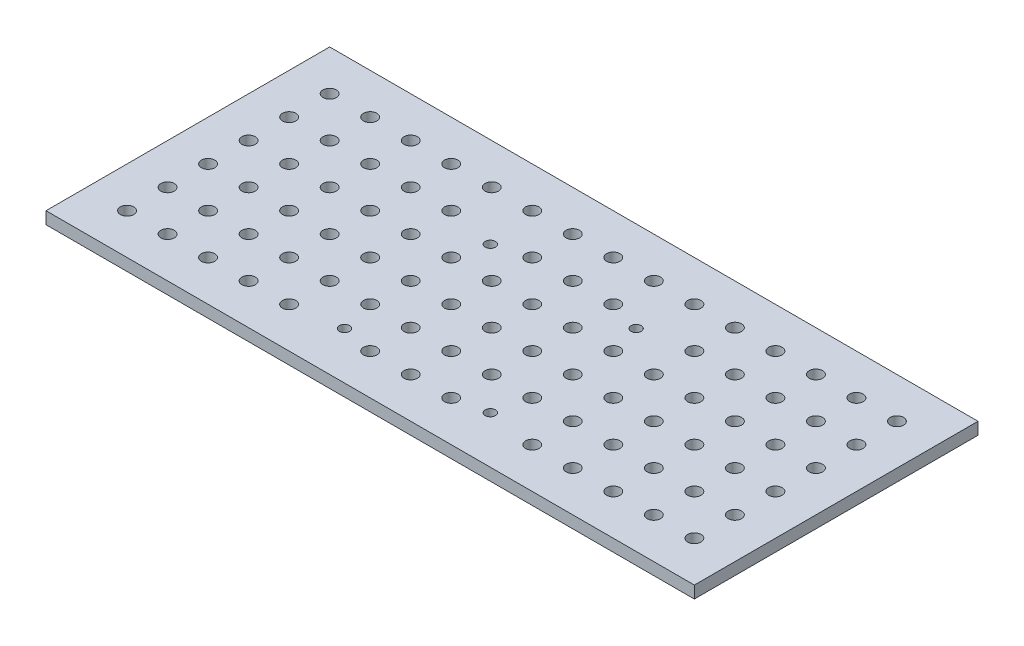
from build123d import *

# Parameters (mm, degrees)
SKETCH_1_W          = 160
SKETCH_1_H          = 70
EXTRUDE_1_DEPTH     = 3
SKETCH_2_R          = 1.65
CUT_EXTRUDE_1_DEPTH = 3
SKETCH_3_R          = 1.65
EXTRUDE_2_DEPTH     = 3
CUT_EXTRUDE_2_DEPTH = 3


with BuildPart() as part:
    # 草图1 → 凸台-拉伸1 (new body)
    with BuildSketch(Plane(origin=(0, 0, 0), x_dir=(1, 0, 0), z_dir=(0, 1, 0))):
        Rectangle(SKETCH_1_W, SKETCH_1_H)
    extrude(amount=EXTRUDE_1_DEPTH)

    # 草图2 → 切除-拉伸1 (cut)
    with BuildSketch(Plane(origin=(0, 3, 0), x_dir=(1, 0, 0), z_dir=(0, 1, 0))):
        with Locations(Location((-70, 25, 0), (0, 0, 270))):
            Circle(SKETCH_2_R)
        with Locations(Location((-60, 25, 0), (0, 0, 270))):
            Circle(SKETCH_2_R)
        with Locations(Location((-50, 25, 0), (0, 0, 270))):
            Circle(SKETCH_2_R)
        with Locations(Location((-40, 25, 0), (0, 0, 270))):
            Circle(SKETCH_2_R)
        with Locations(Location((-30, 25, 0), (0, 0, 270))):
            Circle(SKETCH_2_R)
        with Locations(Location((-20, 25, 0), (0, 0, 270))):
            Circle(SKETCH_2_R)
        with Locations(Location((-10, 25, 0), (0, 0, 270))):
            Circle(SKETCH_2_R)
        with Locations(Location((0, 25, 0), (0, 0, 270))):
            Circle(SKETCH_2_R)
        with Locations(Location((10, 25, 0), (0, 0, 270))):
            Circle(SKETCH_2_R)
        with Locations(Location((20, 25, 0), (0, 0, 270))):
            Circle(SKETCH_2_R)
        with Locations(Location((30, 25, 0), (0, 0, 270))):
            Circle(SKETCH_2_R)
        with Locations(Location((40, 25, 0), (0, 0, 270))):
            Circle(SKETCH_2_R)
        with Locations(Location((50, 25, 0), (0, 0, 270))):
            Circle(SKETCH_2_R)
        with Locations(Location((60, 25, 0), (0, 0, 270))):
            Circle(SKETCH_2_R)
        with Locations(Location((70, 25, 0), (0, 0, 270))):
            Circle(SKETCH_2_R)
        with Locations(Location((-60, 15, 0), (0, 0, 270))):
            Circle(SKETCH_2_R)
        with Locations(Location((-50, 15, 0), (0, 0, 270))):
            Circle(SKETCH_2_R)
        with Locations(Location((-40, 15, 0), (0, 0, 270))):
            Circle(SKETCH_2_R)
        with Locations(Location((-30, 15, 0), (0, 0, 270))):
            Circle(SKETCH_2_R)
        with Locations(Location((-20, 15, 0), (0, 0, 270))):
            Circle(SKETCH_2_R)
        with Locations(Location((-10, 15, 0), (0, 0, 270))):
            Circle(SKETCH_2_R)
        with Locations(Location((0, 15, 0), (0, 0, 270))):
            Circle(SKETCH_2_R)
        with Locations(Location((10, 15, 0), (0, 0, 270))):
            Circle(SKETCH_2_R)
        with Locations(Location((20, 15, 0), (0, 0, 270))):
            Circle(SKETCH_2_R)
        with Locations(Location((30, 15, 0), (0, 0, 270))):
            Circle(SKETCH_2_R)
        with Locations(Location((40, 15, 0), (0, 0, 270))):
            Circle(SKETCH_2_R)
        with Locations(Location((50, 15, 0), (0, 0, 270))):
            Circle(SKETCH_2_R)
        with Locations(Location((60, 15, 0), (0, 0, 270))):
            Circle(SKETCH_2_R)
        with Locations(Location((70, 15, 0), (0, 0, 270))):
            Circle(SKETCH_2_R)
        with Locations(Location((-60, 5, 0), (0, 0, 270))):
            Circle(SKETCH_2_R)
        with Locations(Location((-50, 5, 0), (0, 0, 270))):
            Circle(SKETCH_2_R)
        with Locations(Location((-40, 5, 0), (0, 0, 270))):
            Circle(SKETCH_2_R)
        with Locations(Location((-30, 5, 0), (0, 0, 270))):
            Circle(SKETCH_2_R)
        with Locations(Location((-20, 5, 0), (0, 0, 270))):
            Circle(SKETCH_2_R)
        with Locations(Location((-10, 5, 0), (0, 0, 270))):
            Circle(SKETCH_2_R)
        with Locations(Location((0, 5, 0), (0, 0, 270))):
            Circle(SKETCH_2_R)
        with Locations(Location((10, 5, 0), (0, 0, 270))):
            Circle(SKETCH_2_R)
        with Locations(Location((20, 5, 0), (0, 0, 270))):
            Circle(SKETCH_2_R)
        with Locations(Location((30, 5, 0), (0, 0, 270))):
            Circle(SKETCH_2_R)
        with Locations(Location((40, 5, 0), (0, 0, 270))):
            Circle(SKETCH_2_R)
        with Locations(Location((50, 5, 0), (0, 0, 270))):
            Circle(SKETCH_2_R)
        with Locations(Location((60, 5, 0), (0, 0, 270))):
            Circle(SKETCH_2_R)
        with Locations(Location((70, 5, 0), (0, 0, 270))):
            Circle(SKETCH_2_R)
        with Locations(Location((-60, -5, 0), (0, 0, 270))):
            Circle(SKETCH_2_R)
        with Locations(Location((-50, -5, 0), (0, 0, 270))):
            Circle(SKETCH_2_R)
        with Locations(Location((-40, -5, 0), (0, 0, 270))):
            Circle(SKETCH_2_R)
        with Locations(Location((-30, -5, 0), (0, 0, 270))):
            Circle(SKETCH_2_R)
        with Locations(Location((-20, -5, 0), (0, 0, 270))):
            Circle(SKETCH_2_R)
        with Locations(Location((-10, -5, 0), (0, 0, 270))):
            Circle(SKETCH_2_R)
        with Locations(Location((0, -5, 0), (0, 0, 270))):
            Circle(SKETCH_2_R)
        with Locations(Location((10, -5, 0), (0, 0, 270))):
            Circle(SKETCH_2_R)
        with Locations(Location((20, -5, 0), (0, 0, 270))):
            Circle(SKETCH_2_R)
        with Locations(Location((30, -5, 0), (0, 0, 270))):
            Circle(SKETCH_2_R)
        with Locations(Location((40, -5, 0), (0, 0, 270))):
            Circle(SKETCH_2_R)
        with Locations(Location((50, -5, 0), (0, 0, 270))):
            Circle(SKETCH_2_R)
        with Locations(Location((60, -5, 0), (0, 0, 270))):
            Circle(SKETCH_2_R)
        with Locations(Location((70, -5, 0), (0, 0, 270))):
            Circle(SKETCH_2_R)
        with Locations(Location((-60, -15, 0), (0, 0, 270))):
            Circle(SKETCH_2_R)
        with Locations(Location((-50, -15, 0), (0, 0, 270))):
            Circle(SKETCH_2_R)
        with Locations(Location((-40, -15, 0), (0, 0, 270))):
            Circle(SKETCH_2_R)
        with Locations(Location((-30, -15, 0), (0, 0, 270))):
            Circle(SKETCH_2_R)
        with Locations(Location((-20, -15, 0), (0, 0, 270))):
            Circle(SKETCH_2_R)
        with Locations(Location((-10, -15, 0), (0, 0, 270))):
            Circle(SKETCH_2_R)
        with Locations(Location((0, -15, 0), (0, 0, 270))):
            Circle(SKETCH_2_R)
        with Locations(Location((10, -15, 0), (0, 0, 270))):
            Circle(SKETCH_2_R)
        with Locations(Location((20, -15, 0), (0, 0, 270))):
            Circle(SKETCH_2_R)
        with Locations(Location((30, -15, 0), (0, 0, 270))):
            Circle(SKETCH_2_R)
        with Locations(Location((40, -15, 0), (0, 0, 270))):
            Circle(SKETCH_2_R)
        with Locations(Location((50, -15, 0), (0, 0, 270))):
            Circle(SKETCH_2_R)
        with Locations(Location((60, -15, 0), (0, 0, 270))):
            Circle(SKETCH_2_R)
        with Locations(Location((70, -15, 0), (0, 0, 270))):
            Circle(SKETCH_2_R)
        with Locations(Location((-60, -25, 0), (0, 0, 270))):
            Circle(SKETCH_2_R)
        with Locations(Location((-50, -25, 0), (0, 0, 270))):
            Circle(SKETCH_2_R)
        with Locations(Location((-40, -25, 0), (0, 0, 270))):
            Circle(SKETCH_2_R)
        with Locations(Location((-30, -25, 0), (0, 0, 270))):
            Circle(SKETCH_2_R)
        with Locations(Location((-20, -25, 0), (0, 0, 270))):
            Circle(SKETCH_2_R)
        with Locations(Location((-10, -25, 0), (0, 0, 270))):
            Circle(SKETCH_2_R)
        with Locations(Location((0, -25, 0), (0, 0, 270))):
            Circle(SKETCH_2_R)
        with Locations(Location((10, -25, 0), (0, 0, 270))):
            Circle(SKETCH_2_R)
        with Locations(Location((20, -25, 0), (0, 0, 270))):
            Circle(SKETCH_2_R)
        with Locations(Location((30, -25, 0), (0, 0, 270))):
            Circle(SKETCH_2_R)
        with Locations(Location((40, -25, 0), (0, 0, 270))):
            Circle(SKETCH_2_R)
        with Locations(Location((50, -25, 0), (0, 0, 270))):
            Circle(SKETCH_2_R)
        with Locations(Location((60, -25, 0), (0, 0, 270))):
            Circle(SKETCH_2_R)
        with Locations(Location((70, -25, 0), (0, 0, 270))):
            Circle(SKETCH_2_R)
        with Locations(Location((-70, 15, 0), (0, 0, 270))):
            Circle(SKETCH_2_R)
        with Locations(Location((-70, 5, 0), (0, 0, 270))):
            Circle(SKETCH_2_R)
        with Locations(Location((-70, -5, 0), (0, 0, 270))):
            Circle(SKETCH_2_R)
        with Locations(Location((-70, -15, 0), (0, 0, 270))):
            Circle(SKETCH_2_R)
        with Locations(Location((-70, -25, 0), (0, 0, 270))):
            Circle(SKETCH_2_R)
    extrude(amount=-CUT_EXTRUDE_1_DEPTH, mode=Mode.SUBTRACT)

    # 草图3 → 凸台-拉伸2 (add)
    with BuildSketch(Plane(origin=(0, 3, 0), x_dir=(1, 0, 0), z_dir=(0, 1, 0))):
        with Locations((-20, 15)):
            Circle(SKETCH_3_R)
        with Locations((20, 15)):
            Circle(SKETCH_3_R)
        with Locations((20, -25)):
            Circle(SKETCH_3_R)
        with Locations((-20, -25)):
            Circle(SKETCH_3_R)
    extrude(amount=-EXTRUDE_2_DEPTH)

    # 草图4 → 切除-拉伸2 (cut)
    with BuildSketch(Plane(origin=(0, 3, 0), x_dir=(1, 0, 0), z_dir=(0, 1, 0))):
        with BuildLine():
            Line((-18, 11.4), (-18, 12.65))
            Line((-18, 12.65), (-16.75, 12.65))
            ThreePointArc((-16.75, 12.65), (-18.883883476, 13.533883476), (-18, 11.4))
        make_face()
        with BuildLine():
            Line((-16.75, 12.65), (-18, 12.65))
            Line((-18, 12.65), (-18, 11.4))
            ThreePointArc((-18, 11.4), (-17.116116524, 11.766116524), (-16.75, 12.65))
        make_face()
        with BuildLine():
            ThreePointArc((19.25, 12.65), (18, 13.9), (16.75, 12.65))
            Line((16.75, 12.65), (18, 12.65))
            Line((18, 12.65), (18, 11.4))
            ThreePointArc((18, 11.4), (18.883883476, 11.766116524), (19.25, 12.65))
        make_face()
        with BuildLine():
            Line((18, 12.65), (16.75, 12.65))
            ThreePointArc((16.75, 12.65), (17.116116524, 11.766116524), (18, 11.4))
            Line((18, 11.4), (18, 12.65))
        make_face()
        with BuildLine():
            ThreePointArc((19.25, -23.35), (18.883883476, -22.466116524), (18, -22.1))
            Line((18, -22.1), (18, -23.35))
            Line((18, -23.35), (16.75, -23.35))
            ThreePointArc((16.75, -23.35), (18, -24.6), (19.25, -23.35))
        make_face()
        with BuildLine():
            Line((18, -23.35), (18, -22.1))
            ThreePointArc((18, -22.1), (17.116116524, -22.466116524), (16.75, -23.35))
            Line((16.75, -23.35), (18, -23.35))
        make_face()
        with BuildLine():
            ThreePointArc((-16.75, -23.35), (-17.116116524, -22.466116524), (-18, -22.1))
            Line((-18, -22.1), (-18, -23.35))
            Line((-18, -23.35), (-16.75, -23.35))
        make_face()
        with BuildLine():
            Line((-18, -23.35), (-18, -22.1))
            ThreePointArc((-18, -22.1), (-18.883883476, -24.233883476), (-16.75, -23.35))
            Line((-16.75, -23.35), (-18, -23.35))
        make_face()
    extrude(amount=-CUT_EXTRUDE_2_DEPTH, mode=Mode.SUBTRACT)


solid = part.part
